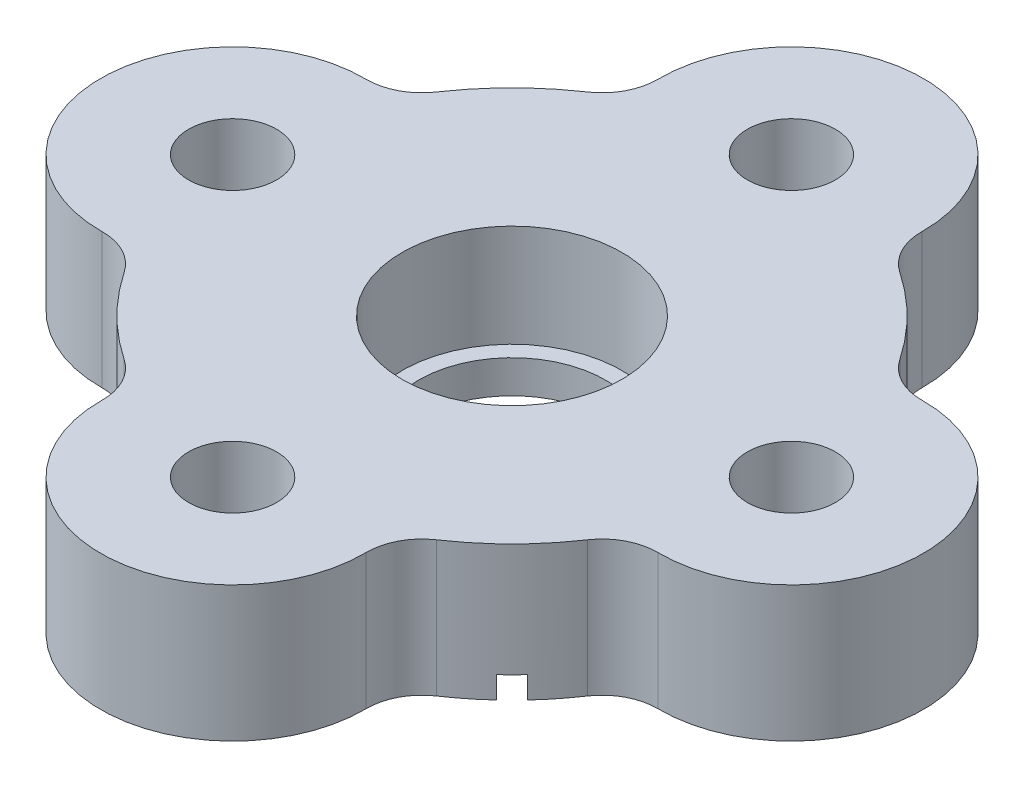
from build123d import *

# Parameters (mm, degrees)
SKETCH1_R                  = 4
SKETCH1_R_2                = 8.5
BODY_AND_CENTER_HOLE_DEPTH = 12.3
SKETCH2_R                  = 10
SEAL_BORE_DEPTH            = 9.3
VENT_DEPTH                 = 2


with BuildPart() as part:
    # Sketch1 → body and center hole (new body)
    with BuildSketch(Plane(origin=(0, 0, 0), x_dir=(1, 0, 0), z_dir=(0, 1, 0))):
        with BuildLine():
            ThreePointArc((11.999195473, 25.261046781), (0, 37.4), (-11.999195473, 25.261046781))
            ThreePointArc((-11.999195473, 25.261046781), (-12.570633341, 22.881338587), (-14.20299508, 21.057894737))
            ThreePointArc((-14.20299508, 21.057894737), (-17.960512242, 17.960512242), (-21.057894737, 14.20299508))
            ThreePointArc((-21.057894737, 14.20299508), (-22.881338587, 12.570633341), (-25.261046781, 11.999195473))
            ThreePointArc((-25.261046781, 11.999195473), (-37.4, 0), (-25.261046781, -11.999195473))
            ThreePointArc((-25.261046781, -11.999195473), (-22.881338587, -12.570633341), (-21.057894737, -14.20299508))
            ThreePointArc((-21.057894737, -14.20299508), (-17.960512242, -17.960512242), (-14.20299508, -21.057894737))
            ThreePointArc((-14.20299508, -21.057894737), (-12.570633341, -22.881338587), (-11.999195473, -25.261046781))
            ThreePointArc((-11.999195473, -25.261046781), (0, -37.4), (11.999195473, -25.261046781))
            ThreePointArc((11.999195473, -25.261046781), (12.570633341, -22.881338587), (14.20299508, -21.057894737))
            ThreePointArc((14.20299508, -21.057894737), (17.960512242, -17.960512242), (21.057894737, -14.20299508))
            ThreePointArc((21.057894737, -14.20299508), (22.881338587, -12.570633341), (25.261046781, -11.999195473))
            ThreePointArc((25.261046781, -11.999195473), (37.4, 0), (25.261046781, 11.999195473))
            ThreePointArc((25.261046781, 11.999195473), (22.881338587, 12.570633341), (21.057894737, 14.20299508))
            ThreePointArc((21.057894737, 14.20299508), (17.960512242, 17.960512242), (14.20299508, 21.057894737))
            ThreePointArc((14.20299508, 21.057894737), (12.570633341, 22.881338587), (11.999195473, 25.261046781))
        make_face()
        with Locations(Location((-25.4, 0, 0), (0, 0, 270))):
            Circle(SKETCH1_R, mode=Mode.SUBTRACT)
        with Locations(Location((0, 25.4, 0), (0, 0, 270))):
            Circle(SKETCH1_R, mode=Mode.SUBTRACT)
        with Locations(Location((25.4, 0, 0), (0, 0, 270))):
            Circle(SKETCH1_R, mode=Mode.SUBTRACT)
        with Locations(Location((0, -25.4, 0), (0, 0, 270))):
            Circle(SKETCH1_R, mode=Mode.SUBTRACT)
        with Locations(Location((0, 0, 0), (0, 0, 270))):
            Circle(SKETCH1_R_2, mode=Mode.SUBTRACT)
    extrude(amount=BODY_AND_CENTER_HOLE_DEPTH)

    # Sketch2 → seal bore (cut)
    with BuildSketch(Plane(origin=(0, 12.3, 0), x_dir=(1, 0, 0), z_dir=(0, 1, 0))):
        with Locations(Location((0, 0, 0), (0, 0, 270))):
            Circle(SKETCH2_R)
    extrude(amount=-SEAL_BORE_DEPTH, mode=Mode.SUBTRACT)

    # Sketch3 → vent (cut)
    with BuildSketch(Plane.XZ):
        Polygon((36.628131265, 35.213917703), (35.213917703, 36.628131265), (-0.707106781, 0.707106781), (0.707106781, -0.707106781), align=None)
    extrude(amount=-VENT_DEPTH, mode=Mode.SUBTRACT)


solid = part.part
